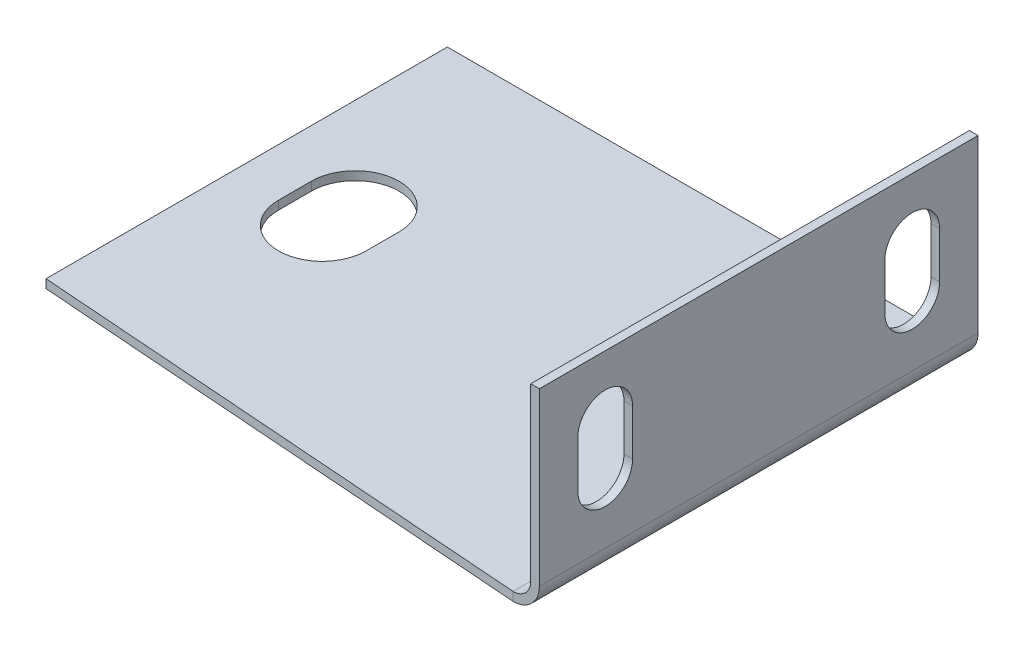
from build123d import *

# Parameters (mm, degrees)
EXTRUDE_THIN1_DEPTH = 25.4
CUT_EXTRUDE1_DEPTH  = 42.405263868
CUT_EXTRUDE2_DEPTH  = 42.33848541


with BuildPart() as part:
    # Sketch3 → Extrude-Thin1 (new body)
    with BuildSketch(Plane.XY):
        with BuildLine():
            Line((0, -0.25), (29.21, -0.25))
            ThreePointArc((29.21, -0.25), (30.284802307, 0.195197693), (30.73, 1.27))
            Line((30.73, 1.27), (30.73, 11.176))
            Line((30.73, 11.176), (30.23, 11.176))
            Line((30.23, 11.176), (30.23, 1.27))
            ThreePointArc((30.23, 1.27), (29.931248917, 0.548751083), (29.21, 0.25))
            Line((29.21, 0.25), (0, 0.25))
            Line((0, 0.25), (0, -0.25))
        make_face()
    extrude(amount=EXTRUDE_THIN1_DEPTH)

    # Sketch4 → Cut-Extrude1 (cut, through all)
    with BuildSketch(Plane(origin=(30.73, 0, 0), x_dir=(0, 0, -1), z_dir=(1, 0, 0))):
        with BuildLine():
            Line((-5.3975, 4.953), (-5.3975, 7.62))
            ThreePointArc((-5.3975, 7.62), (-3.81, 9.2075), (-2.2225, 7.62))
            Line((-2.2225, 7.62), (-2.2225, 4.953))
            ThreePointArc((-2.2225, 4.953), (-3.81, 3.3655), (-5.3975, 4.953))
        make_face()
        with BuildLine():
            Line((-20.0025, 4.953), (-20.0025, 7.62))
            ThreePointArc((-20.0025, 7.62), (-21.59, 9.2075), (-23.1775, 7.62))
            Line((-23.1775, 7.62), (-23.1775, 4.953))
            ThreePointArc((-23.1775, 4.953), (-21.59, 3.3655), (-20.0025, 4.953))
        make_face()
    extrude(amount=-CUT_EXTRUDE1_DEPTH, mode=Mode.SUBTRACT)

    # Sketch5 → Cut-Extrude2 (cut, through all)
    with BuildSketch(Plane(origin=(0, 0.25, 0), x_dir=(1, 0, 0), z_dir=(0, 1, 0))):
        with BuildLine():
            Line((2.794, -12.573), (2.794, -10.668))
            ThreePointArc((2.794, -10.668), (5.334, -8.128), (7.874, -10.668))
            Line((7.874, -10.668), (7.874, -12.573))
            ThreePointArc((7.874, -12.573), (5.334, -15.113), (2.794, -12.573))
        make_face()
        Polygon((29.21, -25.4), (0, -25.4), (0, -23.241), align=None)
    extrude(amount=-CUT_EXTRUDE2_DEPTH, mode=Mode.SUBTRACT)


solid = part.part
